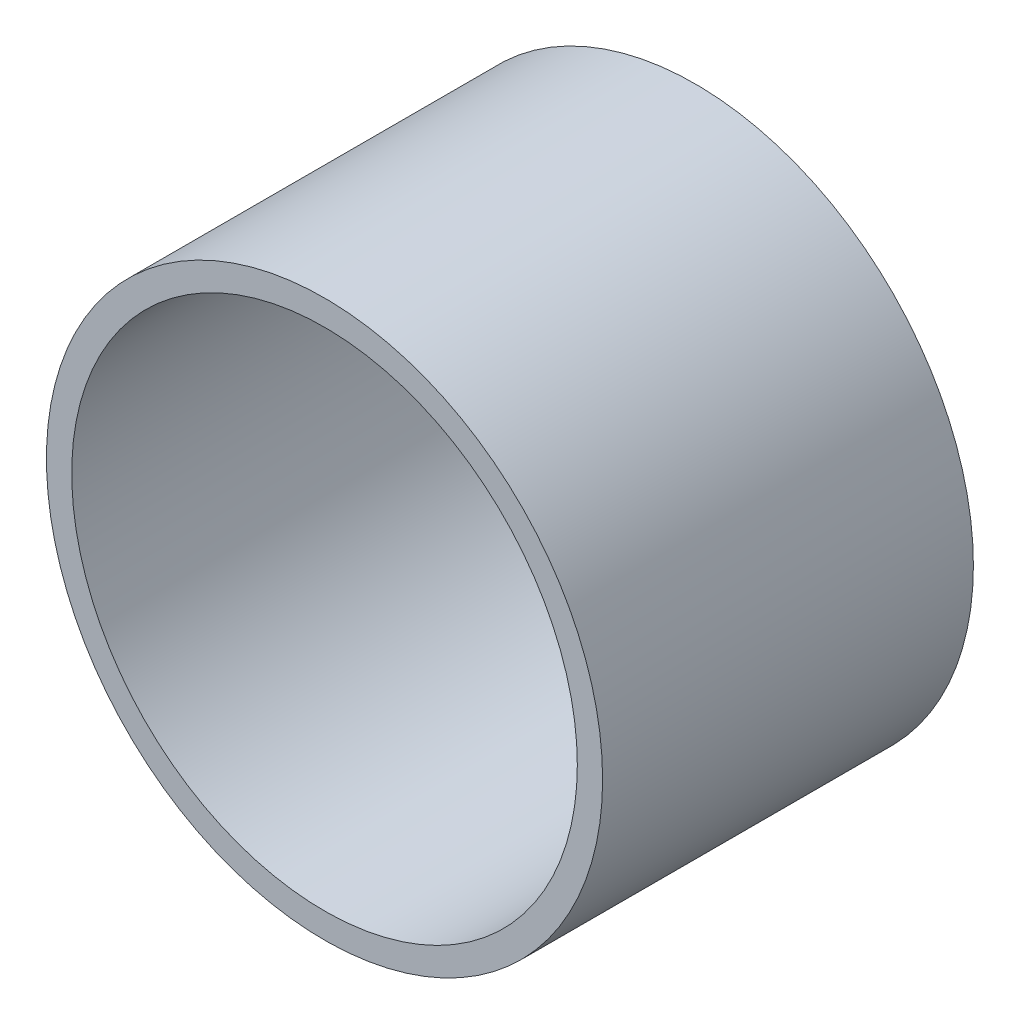
from build123d import *

# Parameters (mm, degrees)
SKETCH1_R           = 16.5
SKETCH1_R_2         = 15
BOSS_EXTRUDE1_DEPTH = 22


with BuildPart() as part:
    # Sketch1 → Boss-Extrude1 (new body)
    with BuildSketch(Plane.XY):
        Circle(SKETCH1_R)
        Circle(SKETCH1_R_2, mode=Mode.SUBTRACT)
    extrude(amount=BOSS_EXTRUDE1_DEPTH)


solid = part.part
